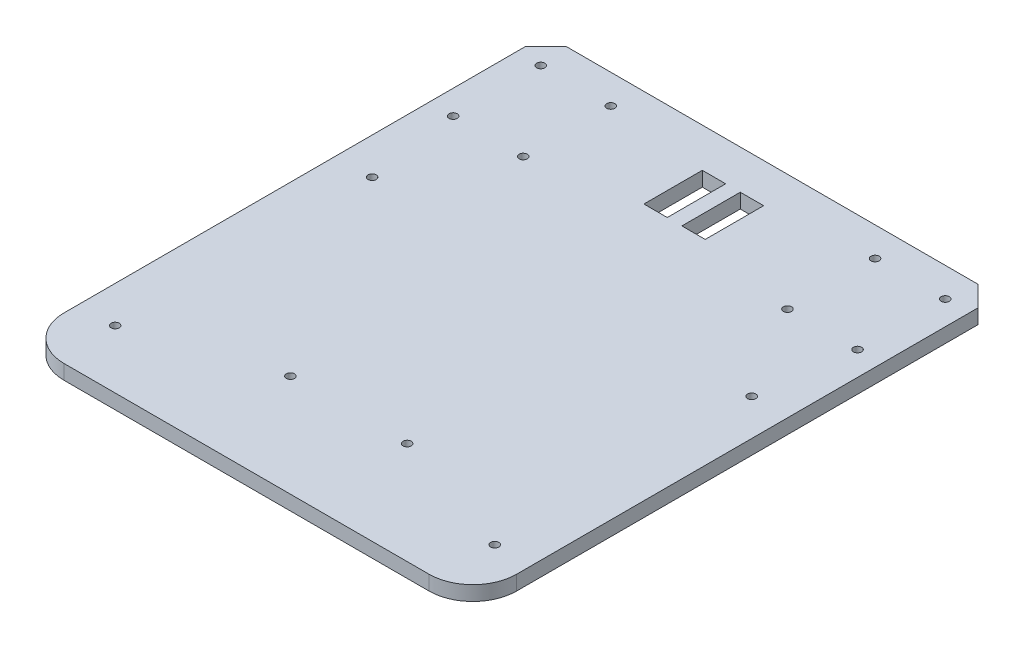
from build123d import *

# Parameters (mm, degrees)
SKETCH7_W           = 155
SKETCH7_H           = 180
BOSS_EXTRUDE2_DEPTH = 5
SKETCH8_R           = 1.4
CUT_EXTRUDE3_DEPTH  = 5
SKETCH9_R           = 1.4
CUT_EXTRUDE4_DEPTH  = 5
CUT_EXTRUDE5_DEPTH  = 5
SKETCH11_W          = 8
SKETCH11_H          = 20
CUT_EXTRUDE6_DEPTH  = 5
CUT_EXTRUDE7_DEPTH  = 5
SKETCH15_R          = 1.4
CUT_EXTRUDE8_DEPTH  = 10


with BuildPart() as part:
    # Sketch7 → Boss-Extrude2 (new body)
    with BuildSketch(Plane(origin=(0, 0, 0), x_dir=(1, 0, 0), z_dir=(0, 1, 0))):
        Rectangle(SKETCH7_W, SKETCH7_H)
    extrude(amount=BOSS_EXTRUDE2_DEPTH)

    # Sketch8 → Cut-Extrude3 (cut)
    with BuildSketch(Plane(origin=(0, 5, 0), x_dir=(1, 0, 0), z_dir=(0, 1, 0))):
        with Locations(Location((-69.25, 80, 0), (0, 0, 270))):
            Circle(SKETCH8_R)
        with Locations(Location((-69.25, 50, 0), (0, 0, 270))):
            Circle(SKETCH8_R)
        with Locations(Location((-45.25, 50, 0), (0, 0, 270))):
            Circle(SKETCH8_R)
        with Locations(Location((-45.25, 80, 0), (0, 0, 270))):
            Circle(SKETCH8_R)
        with Locations(Location((45.25, 80, 0), (0, 0, 90))):
            Circle(SKETCH8_R)
        with Locations(Location((45.25, 50, 0), (0, 0, 90))):
            Circle(SKETCH8_R)
        with Locations(Location((69.25, 50, 0), (0, 0, 90))):
            Circle(SKETCH8_R)
        with Locations(Location((69.25, 80, 0), (0, 0, 90))):
            Circle(SKETCH8_R)
    extrude(amount=-CUT_EXTRUDE3_DEPTH, mode=Mode.SUBTRACT)

    # Sketch9 → Cut-Extrude4 (cut)
    with BuildSketch(Plane(origin=(0, 5, 0), x_dir=(1, 0, 0), z_dir=(0, 1, 0))):
        with Locations(Location((-65, 18, 0), (0, 0, 270))):
            Circle(SKETCH9_R)
        with Locations(Location((65, 18, 0), (0, 0, 90))):
            Circle(SKETCH9_R)
        with Locations(Location((-65, -70, 0), (0, 0, 270))):
            Circle(SKETCH9_R)
        with Locations(Location((65, -70, 0), (0, 0, 90))):
            Circle(SKETCH9_R)
    extrude(amount=-CUT_EXTRUDE4_DEPTH, mode=Mode.SUBTRACT)

    # Sketch10 → Cut-Extrude5 (cut)
    with BuildSketch(Plane(origin=(0, 5, 0), x_dir=(1, 0, 0), z_dir=(0, 1, 0))):
        with BuildLine():
            Line((-77.5, -90), (-62.5, -90))
            ThreePointArc((-62.5, -90), (-73.106601718, -85.606601718), (-77.5, -75))
            Line((-77.5, -75), (-77.5, -90))
        make_face()
        with BuildLine():
            Line((77.5, -90), (77.5, -75))
            ThreePointArc((77.5, -75), (73.106601718, -85.606601718), (62.5, -90))
            Line((62.5, -90), (77.5, -90))
        make_face()
    extrude(amount=-CUT_EXTRUDE5_DEPTH, mode=Mode.SUBTRACT)

    # Sketch11 → Cut-Extrude6 (cut)
    with BuildSketch(Plane(origin=(0, 5, 0), x_dir=(1, 0, 0), z_dir=(0, 1, 0))):
        with Locations((6.5, 66.58550083)):
            Rectangle(SKETCH11_W, SKETCH11_H)
        with Locations((-6.5, 66.58550083)):
            Rectangle(SKETCH11_W, SKETCH11_H)
    extrude(amount=-CUT_EXTRUDE6_DEPTH, mode=Mode.SUBTRACT)

    # Sketch13 → Cut-Extrude7 (cut)
    with BuildSketch(Plane(origin=(0, 5, 0), x_dir=(1, 0, 0), z_dir=(0, 1, 0))):
        Polygon((-70.5, 90), (-77.5, 83), (-77.5, 90), align=None)
        Polygon((70.5, 90), (77.5, 83), (77.5, 90), align=None)
    extrude(amount=-CUT_EXTRUDE7_DEPTH, mode=Mode.SUBTRACT)

    # Sketch15 → Cut-Extrude8 (cut)
    with BuildSketch(Plane(origin=(0, 5, 0), x_dir=(1, 0, 0), z_dir=(0, 1, 0))):
        with Locations(Location((-20, -55, 0), (0, 0, 270))):
            Circle(SKETCH15_R)
        with Locations(Location((20, -55, 0), (0, 0, 270))):
            Circle(SKETCH15_R)
    extrude(amount=-CUT_EXTRUDE8_DEPTH, mode=Mode.SUBTRACT)


solid = part.part
